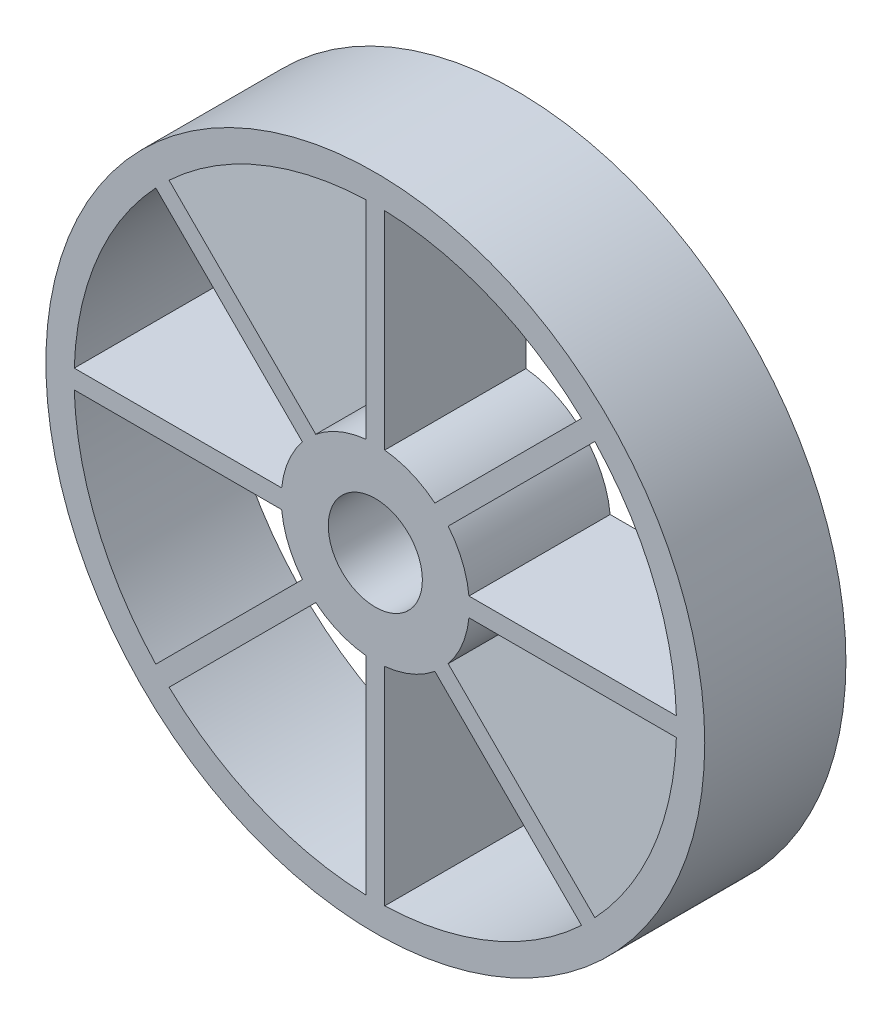
from build123d import *

# Parameters (mm, degrees)
SKETCH1_R           = 10000
SKETCH1_R_2         = 5000
BOSS_EXTRUDE1_DEPTH = 15000
SKETCH2_R           = 35000
SKETCH2_R_2         = 32000
BOSS_EXTRUDE5_DEPTH = 15000
BOSS_EXTRUDE6_DEPTH = 15000


with BuildPart() as part:
    # Sketch1 → Boss-Extrude1 (new body)
    with BuildSketch(Plane.XY):
        Circle(SKETCH1_R)
        Circle(SKETCH1_R_2, mode=Mode.SUBTRACT)
    extrude(amount=BOSS_EXTRUDE1_DEPTH)



with BuildPart() as body_2:
    # Sketch2 → Boss-Extrude5 (new body)
    with BuildSketch(Plane.XY.offset(15000)):
        Circle(SKETCH2_R)
        Circle(SKETCH2_R_2, mode=Mode.SUBTRACT)
    extrude(amount=-BOSS_EXTRUDE5_DEPTH)


with BuildPart() as part_1:
    add(part.part)

    add(body_2.part)  # Boss-Extrude6 merges body 2
    # Sketch3 → Boss-Extrude6 (add)
    with BuildSketch(Plane.XY):
        with BuildLine():
            Line((6328.516858549, 7742.730420922), (21909.258974611, 23323.472536984))
            ThreePointArc((21909.258974611, 23323.472536984), (22627.41699797, 22627.41699797), (23323.472536985, 21909.258974611))
            Line((23323.472536985, 21909.258974611), (7742.730420922, 6328.516858549))
            ThreePointArc((7742.730420922, 6328.516858549), (7071.067811865, 7071.067811865), (6328.516858549, 7742.730420922))
        make_face()
        with BuildLine():
            Line((-1000, 9949.874371066), (-1000, 31984.37118344))
            ThreePointArc((-1000, 31984.37118344), (0, 32000.000000001), (1000, 31984.37118344))
            Line((1000, 31984.37118344), (1000, 9949.874371066))
            ThreePointArc((1000, 9949.874371066), (0, 10000), (-1000, 9949.874371066))
        make_face()
        with BuildLine():
            Line((9949.874371066, 1000), (31984.37118344, 1000))
            ThreePointArc((31984.37118344, 1000), (32000.000000001, 0), (31984.37118344, -1000))
            Line((31984.37118344, -1000), (9949.874371066, -1000))
            ThreePointArc((9949.874371066, -1000), (10000, 0), (9949.874371066, 1000))
        make_face()
        with BuildLine():
            Line((7742.730420922, -6328.516858549), (23323.472536984, -21909.258974611))
            ThreePointArc((23323.472536984, -21909.258974611), (22627.41699797, -22627.41699797), (21909.258974611, -23323.472536985))
            Line((21909.258974611, -23323.472536985), (6328.516858549, -7742.730420922))
            ThreePointArc((6328.516858549, -7742.730420922), (7071.067811865, -7071.067811866), (7742.730420922, -6328.516858549))
        make_face()
        with BuildLine():
            Line((1000, -9949.874371066), (1000, -31984.37118344))
            ThreePointArc((1000, -31984.37118344), (0, -32000.000000001), (-1000, -31984.37118344))
            Line((-1000, -31984.37118344), (-1000, -9949.874371066))
            ThreePointArc((-1000, -9949.874371066), (0, -10000), (1000, -9949.874371066))
        make_face()
        with BuildLine():
            Line((-6328.516858549, -7742.730420922), (-21909.258974611, -23323.472536984))
            ThreePointArc((-21909.258974611, -23323.472536984), (-22627.41699797, -22627.41699797), (-23323.472536985, -21909.258974611))
            Line((-23323.472536985, -21909.258974611), (-7742.730420922, -6328.516858549))
            ThreePointArc((-7742.730420922, -6328.516858549), (-7071.067811866, -7071.067811865), (-6328.516858549, -7742.730420922))
        make_face()
        with BuildLine():
            Line((-9949.874371066, -1000), (-31984.37118344, -1000))
            ThreePointArc((-31984.37118344, -1000), (-32000.000000001, 0), (-31984.37118344, 1000))
            Line((-31984.37118344, 1000), (-9949.874371066, 1000))
            ThreePointArc((-9949.874371066, 1000), (-10000, 0), (-9949.874371066, -1000))
        make_face()
        with BuildLine():
            Line((-7742.730420922, 6328.516858549), (-23323.472536984, 21909.258974611))
            ThreePointArc((-23323.472536984, 21909.258974611), (-22627.41699797, 22627.41699797), (-21909.258974611, 23323.472536985))
            Line((-21909.258974611, 23323.472536985), (-6328.516858549, 7742.730420922))
            ThreePointArc((-6328.516858549, 7742.730420922), (-7071.067811865, 7071.067811866), (-7742.730420922, 6328.516858549))
        make_face()
    extrude(amount=BOSS_EXTRUDE6_DEPTH)


solid = part_1.part
